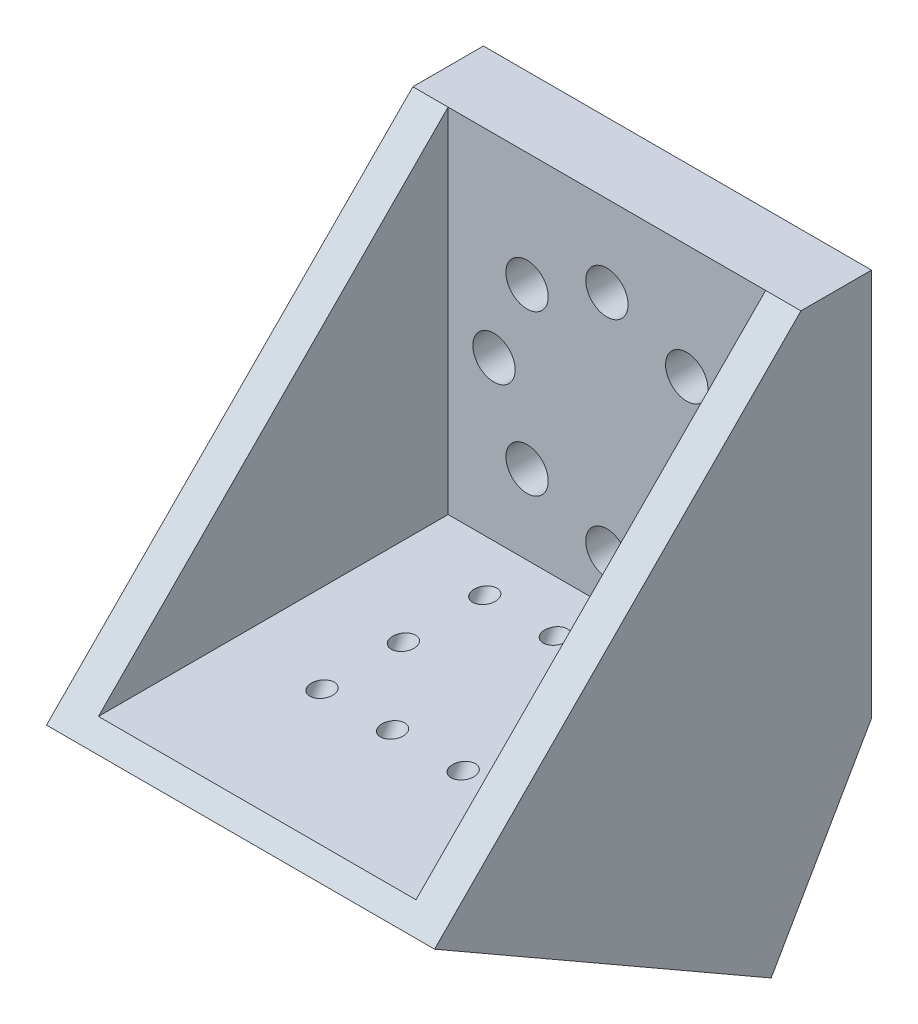
from build123d import *

# Parameters (mm, degrees)
SKETCH_1_W          = 55
SKETCH_1_H          = 55
EXTRUDE_1_DEPTH     = 10
EXTRUDE_2_DEPTH     = 55
CUT_EXTRUDE_1_DEPTH = 50
SKETCH_4_R          = 3
CUT_EXTRUDE_2_DEPTH = 10
SKETCH_5_R          = 1.5
CUT_EXTRUDE_3_DEPTH = 30


with BuildPart() as part:
    # 草图1 → 凸台-拉伸1 (new body)
    with BuildSketch(Plane.XY):
        Rectangle(SKETCH_1_W, SKETCH_1_H)
    extrude(amount=EXTRUDE_1_DEPTH)

    # 草图2 → 凸台-拉伸2 (add)
    with BuildSketch(Plane(origin=(27.5, 0, 0), x_dir=(0, 0, -1), z_dir=(1, 0, 0))):
        Polygon((0, -27.5), (-14.219889521, -52.26914509), (-61.918339647, -24.885612528), (-10, 27.5), align=None)
    extrude(amount=-EXTRUDE_2_DEPTH)

    # 草图3 → 切除-拉伸1 (cut)
    with BuildSketch(Plane(origin=(0, 0, 10), x_dir=(-1, 0, 0), z_dir=(0, 0, -1))):
        Polygon((22.5, 22.5), (22.5, -22.5), (-22.5, -22.5), (-22.5, 22.5), (-22.5, 36.625124929), (22.5, 36.625124929), align=None)
    extrude(amount=-CUT_EXTRUDE_1_DEPTH, mode=Mode.SUBTRACT)

    # 草图4 → 切除-拉伸2 (cut)
    with BuildSketch(Plane(origin=(0, 0, 0), x_dir=(-1, 0, 0), z_dir=(0, 0, -1))):
        with Locations((16, 0)):
            Circle(SKETCH_4_R)
        with Locations((11.313708499, -11.313708499)):
            Circle(SKETCH_4_R)
        with Locations((0, -16)):
            Circle(SKETCH_4_R)
        with Locations((-11.313708499, -11.313708499)):
            Circle(SKETCH_4_R)
        with Locations((-16, 0)):
            Circle(SKETCH_4_R)
        with Locations((-11.313708499, 11.313708499)):
            Circle(SKETCH_4_R)
        with Locations((0, 16)):
            Circle(SKETCH_4_R)
        with Locations((11.313708499, 11.313708499)):
            Circle(SKETCH_4_R)
    extrude(amount=-CUT_EXTRUDE_2_DEPTH, mode=Mode.SUBTRACT)

    # 草图5 → 切除-拉伸3 (cut)
    with BuildSketch(Plane(origin=(0, -45.452255494, 26.093999177), x_dir=(1, 0, 0), z_dir=(0, -0.8672445477434421, 0.4978824102228085))):
        with Locations(Location((10, 23.808233719, 0), (0, 0, 270))):
            Circle(SKETCH_5_R)
        with Locations(Location((10, 13.808233719, 0), (0, 0, 270))):
            Circle(SKETCH_5_R)
        with Locations(Location((0, 23.808233719, 0), (0, 0, 270))):
            Circle(SKETCH_5_R)
        with Locations(Location((-10, 23.808233719, 0), (0, 0, 90))):
            Circle(SKETCH_5_R)
        with Locations(Location((-10, 13.808233719, 0), (0, 0, 90))):
            Circle(SKETCH_5_R)
        with Locations(Location((-10, 3.808233719, 0), (0, 0, 270))):
            Circle(SKETCH_5_R)
        with Locations(Location((0, 3.808233719, 0), (0, 0, 90))):
            Circle(SKETCH_5_R)
        with Locations(Location((10, 3.808233719, 0), (0, 0, 90))):
            Circle(SKETCH_5_R)
    extrude(amount=-CUT_EXTRUDE_3_DEPTH, mode=Mode.SUBTRACT)


solid = part.part
